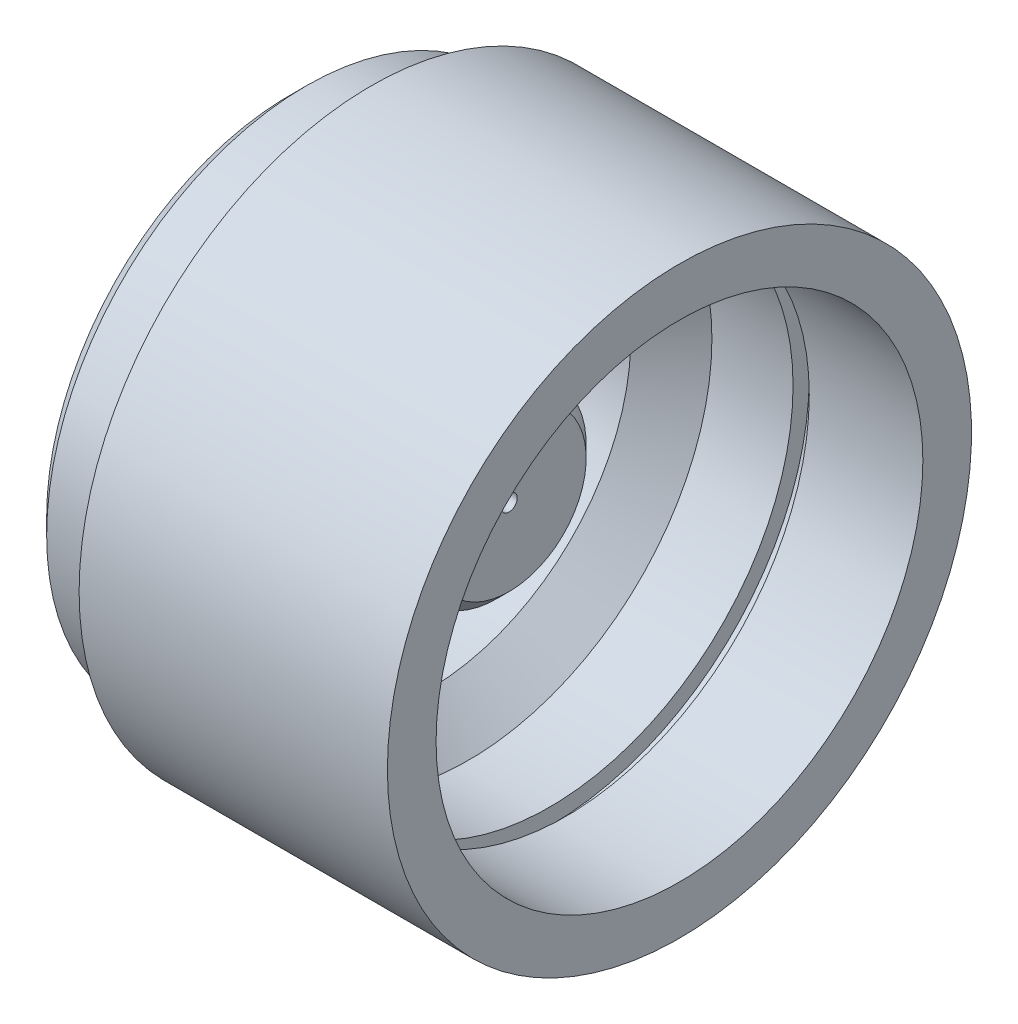
from build123d import *

# Parameters (mm, degrees)
DIAM_TRE_DU_PER_AGE_1_0_1_1_D     = 1
DIAM_TRE_DU_PER_AGE_1_0_1_1_DEPTH = 2
DIAM_TRE_DU_PER_AGE_1_0_1_1_TIP   = 0.30043031
DIAM_TRE_DU_PER_AGE_5_0_5_1_D     = 5
DIAM_TRE_DU_PER_AGE_5_0_5_1_DEPTH = 9.5
DIAM_TRE_DU_PER_AGE_5_0_5_1_TIP   = 1.502151548


with BuildPart() as part:
    # Esquisse7 → Révolution2 (revolve)
    with BuildSketch(Plane.XY, mode=Mode.PRIVATE) as r_volution2_sk:
        Polygon((0, 15), (0, 18), (-19, 18), (-19, 15), (-20, 15), (-20, 16), (-23, 16), (-24, 15), (-24, 8), (-23, 8), (-23, 0), (-10.5, 0), (-10.5, 4.75), (-11.25, 5.5), (-19.75, 5.5), (-20.5, 6.25), (-20.5, 11.75), (-19.75, 12.5), (-15.5, 12.5), (-13, 15), (-8, 15), (-8, 16), (-7, 16), (-7, 15), align=None)
    revolve(r_volution2_sk.sketch.rotate(Axis((-24, 0, 0), (1, 0, 0)), 90), axis=Axis((-24, 0, 0), (1, 0, 0)))

    # Diamètre du perçage Ø1.0 (1)1
    with Locations(Plane(origin=(-10.5, 0, 0), x_dir=(0, 0, -1), z_dir=(1, 0, 0))):
        with Locations((0, 0)):
            Hole(DIAM_TRE_DU_PER_AGE_1_0_1_1_D / 2, depth=DIAM_TRE_DU_PER_AGE_1_0_1_1_DEPTH)
            with Locations((0, 0, -(DIAM_TRE_DU_PER_AGE_1_0_1_1_DEPTH + DIAM_TRE_DU_PER_AGE_1_0_1_1_TIP / 2))):  # 118° drill point
                Cone(0, DIAM_TRE_DU_PER_AGE_1_0_1_1_D / 2, DIAM_TRE_DU_PER_AGE_1_0_1_1_TIP, mode=Mode.SUBTRACT)

    # Diamètre du perçage Ø5.0 (5)1
    with Locations(Plane.ZY.offset(23)):
        with Locations((0, 0)):
            Hole(DIAM_TRE_DU_PER_AGE_5_0_5_1_D / 2, depth=DIAM_TRE_DU_PER_AGE_5_0_5_1_DEPTH)
            with Locations((0, 0, -(DIAM_TRE_DU_PER_AGE_5_0_5_1_DEPTH + DIAM_TRE_DU_PER_AGE_5_0_5_1_TIP / 2))):  # 118° drill point
                Cone(0, DIAM_TRE_DU_PER_AGE_5_0_5_1_D / 2, DIAM_TRE_DU_PER_AGE_5_0_5_1_TIP, mode=Mode.SUBTRACT)


solid = part.part
